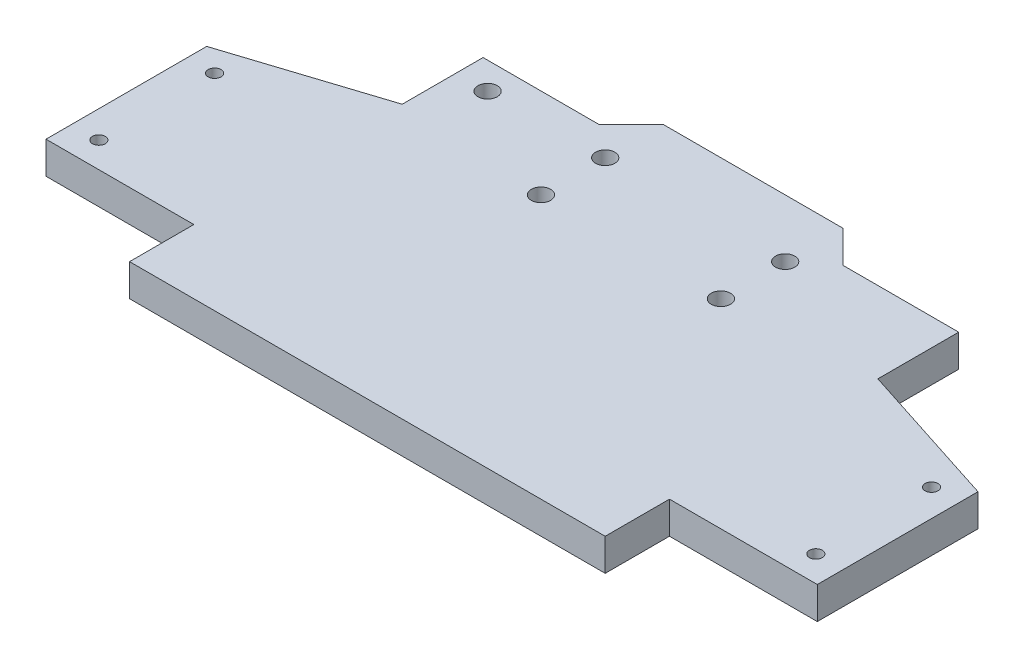
from build123d import *

# Parameters (mm, degrees)
SKETCH1_R           = 1.5
SKETCH1_R_2         = 1
BOSS_EXTRUDE1_DEPTH = 3
SKETCH2_R           = 1
BOSS_EXTRUDE2_DEPTH = 2
BOSS_EXTRUDE4_START = -3
SKETCH3_R           = 1.5
BOSS_EXTRUDE4_DEPTH = 5
SKETCH4_R           = 1.5
CUT_EXTRUDE1_DEPTH  = 168.334993352


with BuildPart() as part:
    # Sketch1 → Boss-Extrude1 (new body)
    with BuildSketch(Plane(origin=(0, 0, 0), x_dir=(1, 0, 0), z_dir=(0, 1, 0))):
        Polygon((-28, -90), (-43, -105), (-74, -115), (-74, -140), (46, -140), (46, -115), (15, -105), (0, -90), align=None)
        with Locations(Location((-28, -99, 0), (0, 0, 270))):
            Circle(SKETCH1_R, mode=Mode.SUBTRACT)
        with Locations(Location((0, -99, 0), (0, 0, 270))):
            Circle(SKETCH1_R, mode=Mode.SUBTRACT)
        with Locations(Location((-28, -109, 0), (0, 0, 270))):
            Circle(SKETCH1_R, mode=Mode.SUBTRACT)
        with Locations(Location((0, -109, 0), (0, 0, 270))):
            Circle(SKETCH1_R, mode=Mode.SUBTRACT)
        with Locations(Location((-69.77, -136, 0), (0, 0, 270))):
            Circle(SKETCH1_R_2, mode=Mode.SUBTRACT)
        with Locations(Location((-69.77, -118, 0), (0, 0, 270))):
            Circle(SKETCH1_R_2, mode=Mode.SUBTRACT)
        with Locations(Location((41.77, -136, 0), (0, 0, 90))):
            Circle(SKETCH1_R_2, mode=Mode.SUBTRACT)
        with Locations(Location((41.77, -118, 0), (0, 0, 90))):
            Circle(SKETCH1_R_2, mode=Mode.SUBTRACT)
    extrude(amount=BOSS_EXTRUDE1_DEPTH)

    # Sketch2 → Boss-Extrude2 (add)
    # profile 1 of 2: a face of its own
    with BuildSketch(Plane(origin=(0, 3, 0), x_dir=(1, 0, 0), z_dir=(0, 1, 0))):
        Polygon((-74, -115), (-74, -140), (-51, -140), (-51, -107.580645161), align=None)
        with Locations(Location((-69.77, -118, 0), (0, 0, 270))):
            Circle(SKETCH2_R, mode=Mode.SUBTRACT)
        with Locations(Location((-69.77, -136, 0), (0, 0, 270))):
            Circle(SKETCH2_R, mode=Mode.SUBTRACT)
    # profile 2 of 2: a face of its own
    with BuildSketch(Plane(origin=(0, 3, 0), x_dir=(1, 0, 0), z_dir=(0, 1, 0))):
        Polygon((46, -115), (46, -140), (23, -140), (23, -107.580645161), align=None)
        with Locations(Location((41.77, -118, 0), (0, 0, 90))):
            Circle(SKETCH2_R, mode=Mode.SUBTRACT)
        with Locations(Location((41.77, -136, 0), (0, 0, 90))):
            Circle(SKETCH2_R, mode=Mode.SUBTRACT)
    extrude(amount=BOSS_EXTRUDE2_DEPTH)

    # Sketch3 → Boss-Extrude4 (add)
    with BuildSketch(Plane(origin=(0, 3, 0), x_dir=(1, 0, 0), z_dir=(0, 1, 0)).offset(BOSS_EXTRUDE4_START)):
        Polygon((-51, -150), (23, -150), (23, -95), (5, -95), (0, -90), (-28, -90), (-33, -95), (-51, -95), align=None)
        with Locations(Location((-28, -99, 0), (0, 0, 270))):
            Circle(SKETCH3_R, mode=Mode.SUBTRACT)
        with Locations(Location((0, -99, 0), (0, 0, 270))):
            Circle(SKETCH3_R, mode=Mode.SUBTRACT)
        with Locations(Location((0, -109, 0), (0, 0, 270))):
            Circle(SKETCH3_R, mode=Mode.SUBTRACT)
        with Locations(Location((-28, -109, 0), (0, 0, 270))):
            Circle(SKETCH3_R, mode=Mode.SUBTRACT)
    extrude(amount=BOSS_EXTRUDE4_DEPTH)

    # Sketch4 → Cut-Extrude1 (cut, through all)
    with BuildSketch(Plane(origin=(0, 5, 0), x_dir=(1, 0, 0), z_dir=(0, 1, 0))):
        with Locations(Location((-46.11, -99.19, 0), (0, 0, 270))):
            Circle(SKETCH4_R)
    extrude(amount=-CUT_EXTRUDE1_DEPTH, mode=Mode.SUBTRACT)


solid = part.part
